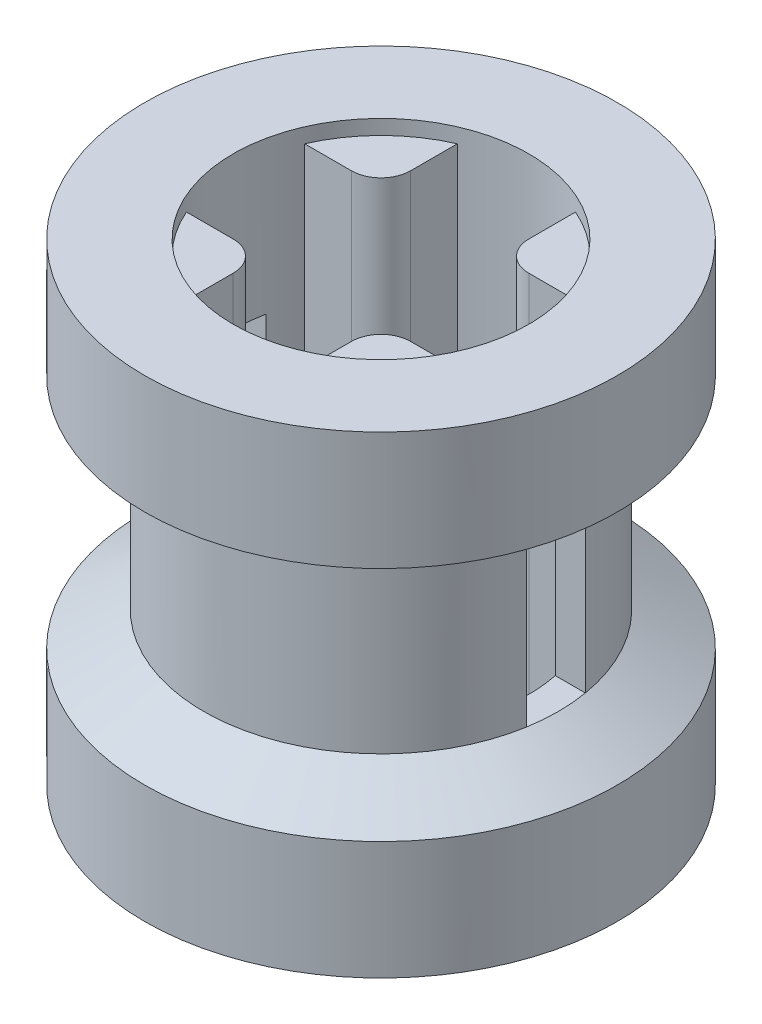
from build123d import *

# Parameters (mm, degrees)
SKETCH1_R               = 3
SKETCH1_R_2             = 2.5
BOSS_EXTRUDE1_DEPTH     = 8
BOSS_EXTRUDE2_START     = 0.25
BOSS_EXTRUDE2_DEPTH     = 7.5
SKETCH4_R               = 4
SKETCH4_R_2             = 3
BOSS_EXTRUDE3_DEPTH     = 2
BOSS_EXTRUDE4_START     = 6
SKETCH4_2_R             = 4
SKETCH4_2_R_2           = 3
BOSS_EXTRUDE4_DEPTH     = 2
CUT_EXTRUDE1_DEPTH      = 10
CUT_EXTRUDE1_DEPTH_BACK = 10
SKETCH6_W               = 1
SKETCH6_H               = 2.845299462


with BuildPart() as part:
    # Sketch1 → Boss-Extrude1 (new body)
    with BuildSketch(Plane(origin=(0, 0, 0), x_dir=(1, 0, 0), z_dir=(0, 1, 0))):
        Circle(SKETCH1_R)
        Circle(SKETCH1_R_2, mode=Mode.SUBTRACT)
    extrude(amount=BOSS_EXTRUDE1_DEPTH)

    # Sketch3 → Boss-Extrude2 (add)
    with BuildSketch(Plane(origin=(0, 0, 0), x_dir=(1, 0, 0), z_dir=(0, 1, 0)).offset(BOSS_EXTRUDE2_START)):
        with BuildLine():
            Line((1, 2.291287847), (1, 1.5))
            ThreePointArc((1, 1.5), (1.146446609, 1.146446609), (1.5, 1))
            Line((1.5, 1), (2.291287847, 1))
            ThreePointArc((2.291287847, 1), (1.767766953, 1.767766953), (1, 2.291287847))
        make_face()
        with BuildLine():
            Line((1, -2.291287847), (1, -1.5))
            ThreePointArc((1, -1.5), (1.146446609, -1.146446609), (1.5, -1))
            Line((1.5, -1), (2.291287847, -1))
            ThreePointArc((2.291287847, -1), (1.767766953, -1.767766953), (1, -2.291287847))
        make_face()
        with BuildLine():
            Line((-2.291287847, -1), (-1.5, -1))
            ThreePointArc((-1.5, -1), (-1.146446609, -1.146446609), (-1, -1.5))
            Line((-1, -1.5), (-1, -2.291287847))
            ThreePointArc((-1, -2.291287847), (-1.767766953, -1.767766953), (-2.291287847, -1))
        make_face()
        with BuildLine():
            Line((-1, 2.291287847), (-1, 1.5))
            ThreePointArc((-1, 1.5), (-1.146446609, 1.146446609), (-1.5, 1))
            Line((-1.5, 1), (-2.291287847, 1))
            ThreePointArc((-2.291287847, 1), (-1.767766953, 1.767766953), (-1, 2.291287847))
        make_face()
    extrude(amount=BOSS_EXTRUDE2_DEPTH)

    # Sketch4 → Boss-Extrude3 (add)
    with BuildSketch(Plane(origin=(0, 0, 0), x_dir=(1, 0, 0), z_dir=(0, 1, 0))):
        Circle(SKETCH4_R)
        Circle(SKETCH4_R_2, mode=Mode.SUBTRACT)
    extrude(amount=BOSS_EXTRUDE3_DEPTH)

    # Sketch4<2> → Boss-Extrude4 (add)
    with BuildSketch(Plane(origin=(0, 0, 0), x_dir=(1, 0, 0), z_dir=(0, 1, 0)).offset(BOSS_EXTRUDE4_START)):
        Circle(SKETCH4_2_R)
        Circle(SKETCH4_2_R_2, mode=Mode.SUBTRACT)
    extrude(amount=BOSS_EXTRUDE4_DEPTH)

    # Sketch5 → Revolve1 (revolve)
    with BuildSketch(Plane(origin=(0, 0, 0), x_dir=(0, 0, -1), z_dir=(1, 0, 0))):
        Polygon((3, 2.577350269), (4, 2), (3, 2), align=None)
        Polygon((3, 6), (4, 6), (3, 5.422649731), align=None)
    revolve(axis=Axis((0, -0.512701632, 0), (0, 1, 0)))

    # Sketch6 → Cut-Extrude1 (cut, two sides: drawn at the far end of the back side and taken through both)
    with BuildSketch(Plane(origin=(0, 0, 0), x_dir=(0, 0, -1), z_dir=(1, 0, 0)).offset(-CUT_EXTRUDE1_DEPTH_BACK)):
        with Locations((0, 4)):
            Rectangle(SKETCH6_W, SKETCH6_H)
    extrude(amount=CUT_EXTRUDE1_DEPTH + CUT_EXTRUDE1_DEPTH_BACK, mode=Mode.SUBTRACT)


solid = part.part
